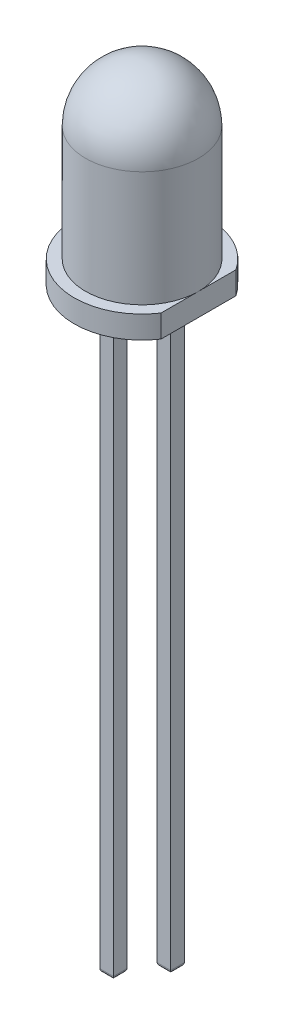
from build123d import *

# Parameters (mm, degrees)
SKETCH1_R               = 2.5
BOSS_EXTRUDE1_DEPTH     = 4.3
SKETCH2_R               = 3
BOSS_EXTRUDE2_DEPTH     = 1
FILLET1_R               = 2.5
CUT_EXTRUDE1_DEPTH      = 7.040695324
CUT_EXTRUDE1_DEPTH_BACK = 7.040695324
SKETCH3_W               = 0.954190985
SKETCH3_H               = 1.425570426
SKETCH4_W               = 0.6
SKETCH4_H               = 0.6
BOSS_EXTRUDE3_DEPTH     = 27
SKETCH4_3_W             = 0.6
SKETCH4_3_H             = 0.6
BOSS_EXTRUDE4_DEPTH     = 25.5
FILLET2_R               = 0.15
FILLET3_R               = 0.15
FILLET4_R               = 0.15
FILLET5_R               = 0.15


with BuildPart() as part:
    # Sketch1 → Boss-Extrude1 (new, symmetric)
    with BuildSketch(Plane(origin=(0, 0, 0), x_dir=(1, 0, 0), z_dir=(0, 1, 0))):
        Circle(SKETCH1_R)
    extrude(amount=BOSS_EXTRUDE1_DEPTH, both=True)

    # Sketch2 → Boss-Extrude2 (add)
    with BuildSketch(Plane.XZ.offset(4.3)):
        Circle(SKETCH2_R)
    extrude(amount=-BOSS_EXTRUDE2_DEPTH)

    # Fillet1
    fillet1_edges = [part.edges().sort_by_distance(p)[0] for p in [
        (-2.5, 4.3, 0),
    ]]
    fillet(fillet1_edges, radius=FILLET1_R)

    # Sketch3 → Cut-Extrude1 (cut, two sides: drawn at the far end of the back side and taken through both)
    with BuildSketch(Plane.XY.offset(-CUT_EXTRUDE1_DEPTH_BACK)):
        with Locations((2.977095493, -4.012785213)):
            Rectangle(SKETCH3_W, SKETCH3_H)
    extrude(amount=CUT_EXTRUDE1_DEPTH + CUT_EXTRUDE1_DEPTH_BACK, mode=Mode.SUBTRACT)

    # Sketch4 → Boss-Extrude3 (add)
    with BuildSketch(Plane.XZ.offset(4.3)):
        with Locations((-1.27, 0)):
            Rectangle(SKETCH4_W, SKETCH4_H)
    extrude(amount=BOSS_EXTRUDE3_DEPTH)

    # Sketch4<3> → Boss-Extrude4 (add)
    with BuildSketch(Plane.XZ.offset(4.3)):
        with Locations((1.27, 0)):
            Rectangle(SKETCH4_3_W, SKETCH4_3_H)
    extrude(amount=BOSS_EXTRUDE4_DEPTH)

    # Fillet2
    fillet2_edges = [part.edges().sort_by_distance(p)[0] for p in [
        (-1.57, -4.3, 0),
        (-1.27, -4.3, -0.3),
        (-0.97, -4.3, 0),
        (-1.27, -4.3, 0.3),
    ]]
    fillet(fillet2_edges, radius=FILLET2_R)

    # Fillet3
    fillet3_edges = [part.edges().sort_by_distance(p)[0] for p in [
        (1.27, -4.3, -0.3),
        (1.57, -4.3, 0),
        (0.97, -4.3, 0),
        (1.27, -4.3, 0.3),
    ]]
    fillet(fillet3_edges, radius=FILLET3_R)

    # Fillet4
    fillet4_edges = [part.edges().sort_by_distance(p)[0] for p in [
        (-1.57, -31.3, 0),
        (-1.27, -31.3, 0.3),
        (-0.97, -31.3, 0),
        (-1.27, -31.3, -0.3),
    ]]
    fillet(fillet4_edges, radius=FILLET4_R)

    # Fillet5
    fillet5_edges = [part.edges().sort_by_distance(p)[0] for p in [
        (1.27, -29.8, 0.3),
        (1.57, -29.8, 0),
        (1.27, -29.8, -0.3),
        (0.97, -29.8, 0),
    ]]
    fillet(fillet5_edges, radius=FILLET5_R)


solid = part.part
